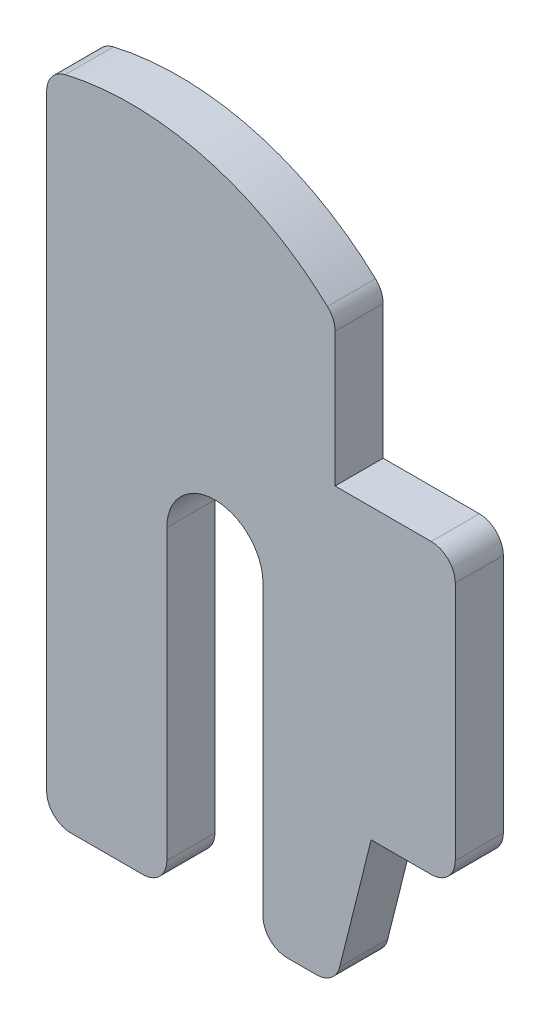
from build123d import *

# Parameters (mm, degrees)
RESSALTO_EXTRUS_O1_DEPTH = 2


with BuildPart() as part:
    # Esboço1 → Ressalto-extrusão1 (new body)
    with BuildSketch(Plane.XY):
        with BuildLine():
            Line((0, 1), (0, 26.234323652))
            ThreePointArc((0, 26.234323652), (0.216479701, 26.855689841), (0.772191883, 27.208029697))
            ThreePointArc((0.772191883, 27.208029697), (6.58904443, 27.120718638), (11.681282792, 24.30780107))
            ThreePointArc((11.681282792, 24.30780107), (11.916864982, 23.974978194), (12, 23.575780744))
            Line((12, 23.575780744), (12, 18))
            Line((12, 18), (16, 18))
            ThreePointArc((16, 18), (16.707106781, 17.707106781), (17, 17))
            Line((17, 17), (17, 7))
            ThreePointArc((17, 7), (16.707106781, 6.292893219), (16, 6))
            Line((16, 6), (13.5, 6))
            Line((13.5, 6), (12.189366094, 0.757464375))
            ThreePointArc((12.189366094, 0.757464375), (11.834635803, 0.211794562), (11.219223594, 0))
            Line((11.219223594, 0), (10, 0))
            ThreePointArc((10, 0), (9.292893219, 0.292893219), (9, 1))
            Line((9, 1), (9, 13))
            ThreePointArc((9, 13), (7, 15), (5, 13))
            Line((5, 13), (5, 1))
            ThreePointArc((5, 1), (4.707106781, 0.292893219), (4, 0))
            Line((4, 0), (1, 0))
            ThreePointArc((1, 0), (0.292893219, 0.292893219), (0, 1))
        make_face()
    extrude(amount=RESSALTO_EXTRUS_O1_DEPTH)


solid = part.part
